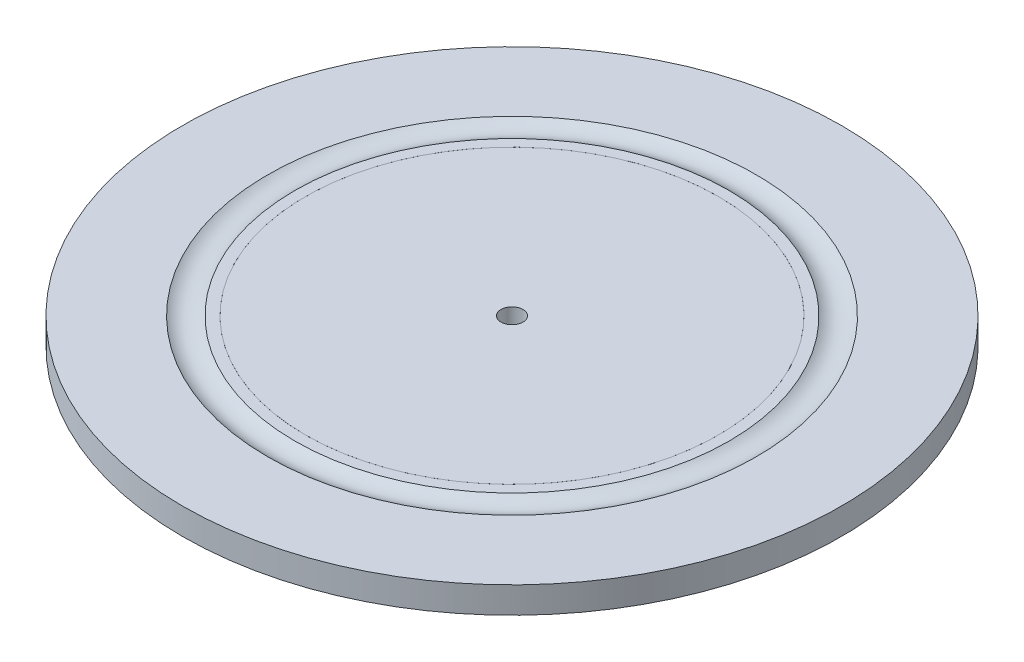
from build123d import *

# Parameters (mm, degrees)
SKETCH2_R           = 75
SKETCH2_R_2         = 59
SKETCH2_R_3         = 46.992946112
BOSS_EXTRUDE1_DEPTH = 6
SKETCH9_R           = 2.5
CUT_EXTRUDE5_DEPTH  = 6


with BuildPart() as part:
    # Sketch1 → Revolve1 (revolve)
    with BuildSketch(Plane(origin=(0, 0, 0), x_dir=(-1, 0, 0), z_dir=(0, 0, -1)), mode=Mode.PRIVATE) as revolve1_sk:
        with BuildLine():
            Line((-59, 0.8724), (-47, 0.8724))
            ThreePointArc((-47, 0.8724), (-46.292893219, 1.165293219), (-46, 1.8724))
            Line((-46, 1.8724), (-46, 5.8724))
            Line((-46, 5.8724), (-47, 6.8724))
            Line((-47, 6.8724), (-49.4043, 6.8724))
            ThreePointArc((-49.4043, 6.8724), (-52.5, 5.8405), (-55.5957, 6.8724))
            Line((-55.5957, 6.8724), (-59, 6.8724))
            Line((-59, 6.8724), (-60, 5.8724))
            Line((-60, 5.8724), (-60, 1.8724))
            ThreePointArc((-60, 1.8724), (-59.707106781, 1.165293219), (-59, 0.8724))
        make_face()
    revolve(revolve1_sk.sketch.rotate(Axis((0, 0, 0), (0, 1, 0)), 270), axis=Axis((0, 0, 0), (0, 1, 0)))

    # Sketch2 → Boss-Extrude1 (add)
    # profile 1 of 2: a face of its own
    with BuildSketch(Plane.XZ.offset(-0.8724)):
        with Locations(Location((0, 0, 0), (0, 0, 270))):
            Circle(SKETCH2_R)
        Circle(SKETCH2_R_2, mode=Mode.SUBTRACT)
    # profile 2 of 2: a face of its own
    with BuildSketch(Plane.XZ.offset(-0.8724)):
        with Locations(Location((0, 0, 0), (0, 0, 270))):
            Circle(SKETCH2_R_3)
    extrude(amount=-BOSS_EXTRUDE1_DEPTH)

    # Sketch9 → Cut-Extrude5 (cut)
    with BuildSketch(Plane(origin=(0, 6.8724, 0), x_dir=(1, 0, 0), z_dir=(0, 1, 0))):
        with Locations(Location((0, 0, 0), (0, 0, 270))):
            Circle(SKETCH9_R)
    extrude(amount=-CUT_EXTRUDE5_DEPTH, mode=Mode.SUBTRACT)


solid = part.part
